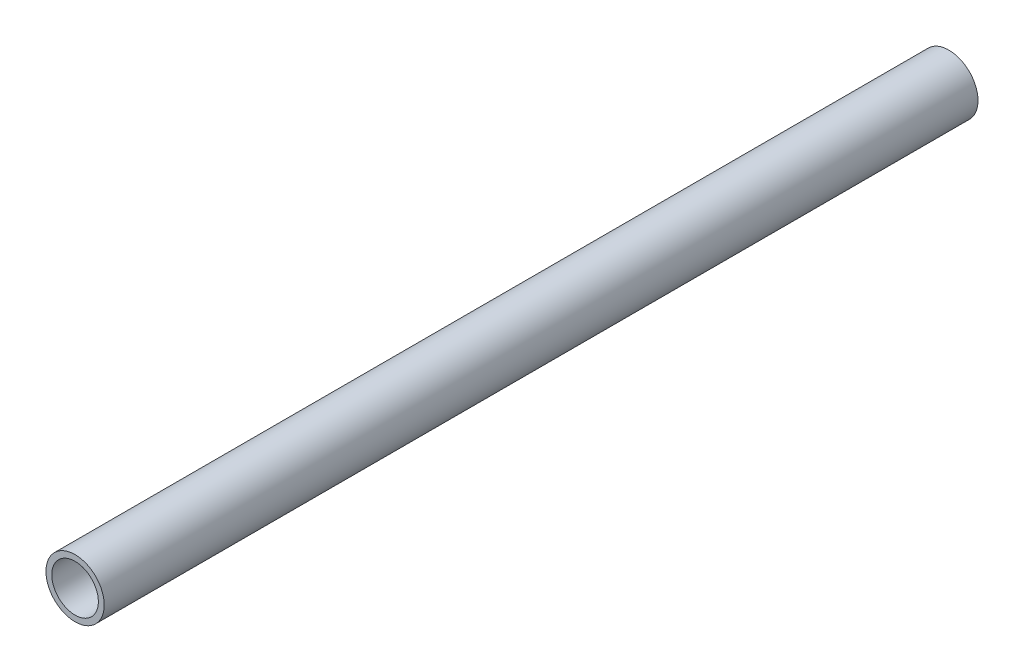
from build123d import *

# Parameters (mm, degrees)
SKETCH1_R           = 10
SKETCH1_R_2         = 8
BOSS_EXTRUDE1_DEPTH = 300


with BuildPart() as part:
    # Sketch1 → Boss-Extrude1 (new body)
    with BuildSketch(Plane.XY):
        Circle(SKETCH1_R)
        Circle(SKETCH1_R_2, mode=Mode.SUBTRACT)
    extrude(amount=BOSS_EXTRUDE1_DEPTH)


solid = part.part
